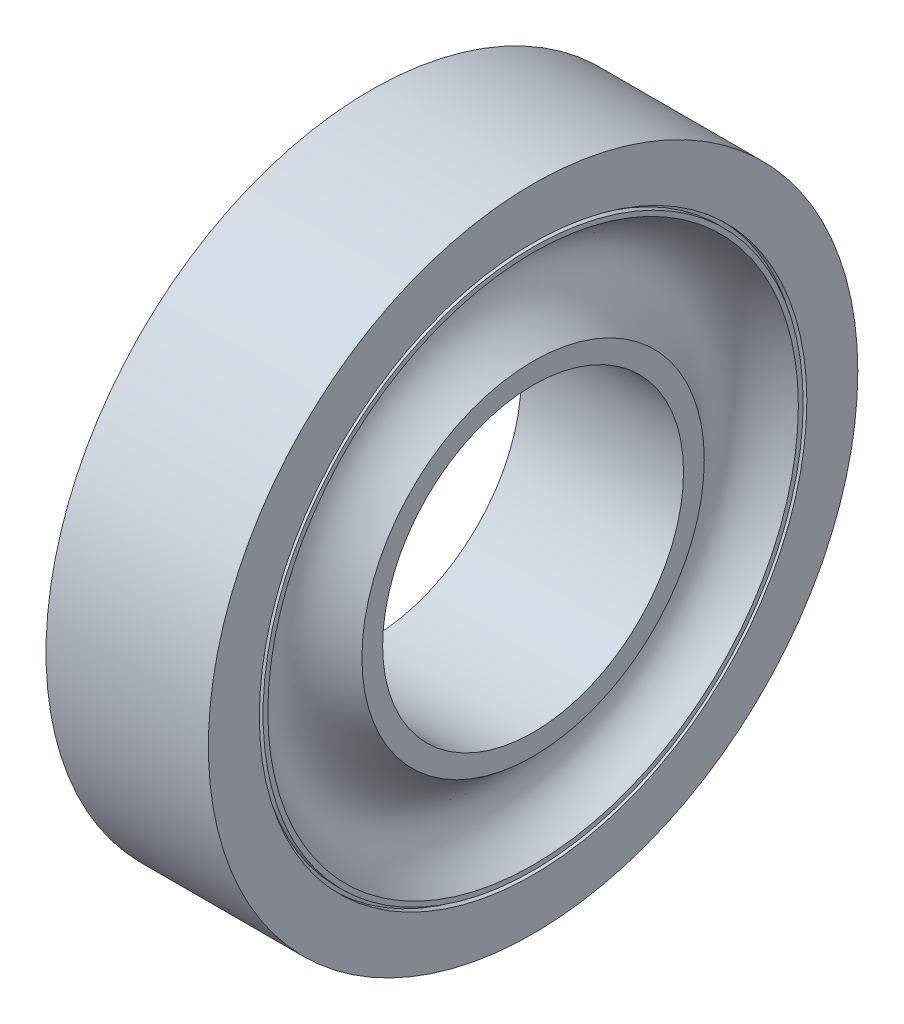
from build123d import *


with BuildPart() as part:
    # Sketch1 → Revolve1 (revolve)
    with BuildSketch(Plane.XY, mode=Mode.PRIVATE) as revolve1_sk:
        with BuildLine():
            Line((7.5, 13.9), (-7.5, 13.9))
            Line((-7.5, 13.9), (-7.5, 15.815032431))
            add(Edge.make_bspline(
                [(-7.5, 15.815032431), (-0.221533759, 20.854783747), (-7.5, 24.507708918)],
                knots=[0, 0, 0, 1, 1, 1], degree=2))
            Line((-7.5, 24.507708918), (-7.5, 24.950271606))
            Line((-7.5, 24.950271606), (-6.958076182, 24.950271606))
            Line((-6.958076182, 24.950271606), (-6.958076182, 25.292900784))
            Line((-6.958076182, 25.292900784), (-7.5, 25.292900784))
            Line((-7.5, 25.292900784), (-7.5, 30))
            Line((-7.5, 30), (7.5, 30))
            Line((7.5, 30), (7.5, 25.292900784))
            Line((7.5, 25.292900784), (6.958076182, 25.292900784))
            Line((6.958076182, 25.292900784), (6.958076182, 24.950271606))
            Line((6.958076182, 24.950271606), (7.5, 24.950271606))
            Line((7.5, 24.950271606), (7.5, 24.507708918))
            add(Edge.make_bspline(
                [(7.5, 15.815032431), (0.221533759, 20.854783747), (7.5, 24.507708918)],
                knots=[0, 0, 0, 1, 1, 1], degree=2))
            Line((7.5, 15.815032431), (7.5, 13.9))
        make_face()
    revolve(revolve1_sk.sketch.rotate(Axis((37.422784058, 0, 0), (-1, 0, 0)), 90), axis=Axis((37.422784058, 0, 0), (-1, 0, 0)))


solid = part.part
